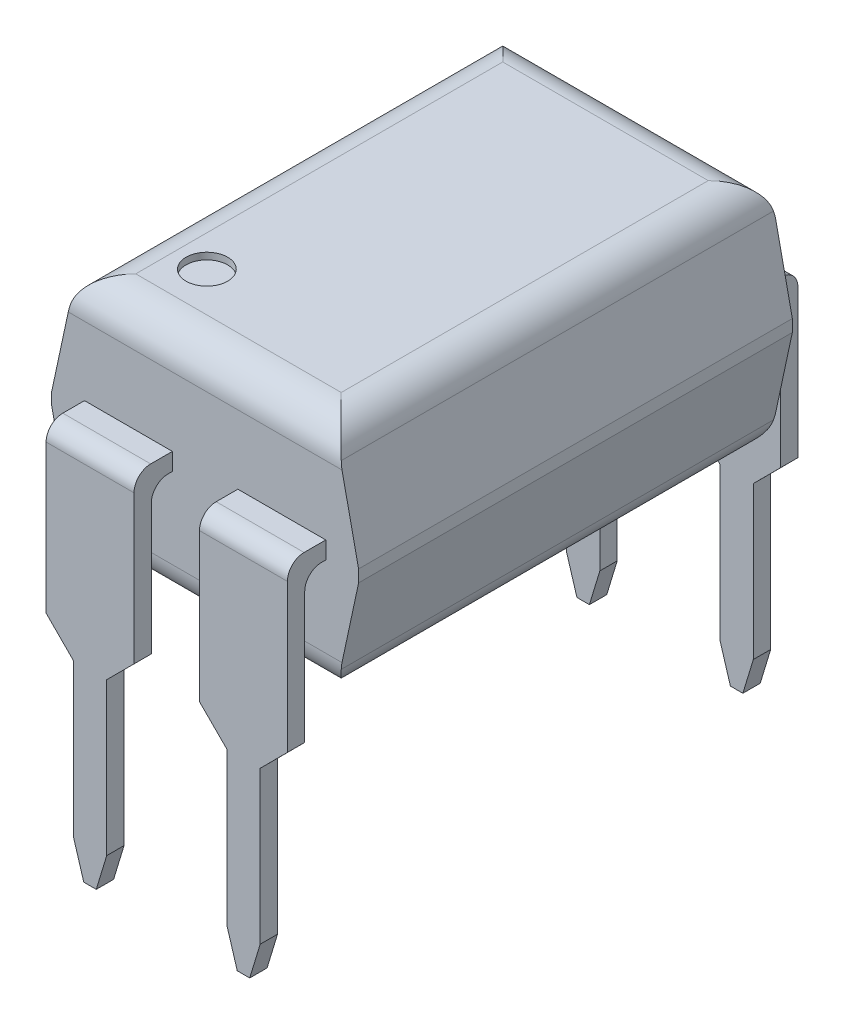
from build123d import *

# Parameters (mm, degrees)
SKETCH1_W               = 4.6
SKETCH1_H               = 6.5
BOSS_EXTRUDE1_DEPTH     = 3.5
SKETCH2_R               = 0.311751624
CUT_EXTRUDE1_DEPTH      = 0.1
SKETCH3_OUTSIDE_W       = 8.34
SKETCH3_OUTSIDE_H       = 7.24
CUT_EXTRUDE3_DEPTH      = 8.732399369
FILLET1_R               = 0.5
BOSS_EXTRUDE2_DEPTH     = 4.6
CUT_EXTRUDE7_DEPTH      = 9.807718938
CUT_EXTRUDE7_DEPTH_BACK = 9.807718938
SKETCH5_OUTSIDE_W       = 8.894
SKETCH5_OUTSIDE_H       = 11.503


with BuildPart() as part:
    # Sketch1 → Boss-Extrude1 (new body)
    with BuildSketch(Plane(origin=(0, 0, 0), x_dir=(1, 0, 0), z_dir=(0, 1, 0))):
        Rectangle(SKETCH1_W, SKETCH1_H)
    extrude(amount=BOSS_EXTRUDE1_DEPTH)

    # Sketch2 → Cut-Extrude1 (cut)
    with BuildSketch(Plane(origin=(0, 3.5, 0), x_dir=(1, 0, 0), z_dir=(0, 1, 0))):
        with Locations(Location((-1.067569718, -2.156407837, 0), (0, 0, 270))):
            Circle(SKETCH2_R)
    extrude(amount=-CUT_EXTRUDE1_DEPTH, mode=Mode.SUBTRACT)

    # Sketch3 outside → Cut-Extrude3 (cut, through all)
    with BuildSketch(Plane.XY.offset(3.25)):
        with Locations((0, 1.75)):
            Rectangle(SKETCH3_OUTSIDE_W, SKETCH3_OUTSIDE_H)
        Polygon((-2.3, 1.84057033), (-1.943948555, 3.5), (1.943948555, 3.5), (2.3, 1.84057033), (2.3, 1.65942967), (1.943948555, 0), (-1.943948555, 0), (-2.3, 1.65942967), align=None, mode=Mode.SUBTRACT)
    extrude(amount=-CUT_EXTRUDE3_DEPTH, mode=Mode.SUBTRACT)

    # Fillet1
    fillet1_edges = [part.edges().sort_by_distance(p)[0] for p in [
        (0, 0, 3.25),
        (0, 0, -3.25),
        (0, 3.5, -3.25),
        (0, 3.5, 3.25),
        (1.943948555, 3.5, 0),
        (-1.943948555, 3.5, 0),
        (1.943948555, 0, 0),
        (-1.943948555, 0, 0),
    ]]
    fillet(fillet1_edges, radius=FILLET1_R)


with BuildPart() as body_2:
    # Sketch4 → Boss-Extrude2 (new, through all)
    with BuildSketch(Plane.ZY.offset(2.3)):
        with BuildLine():
            Line((-3.825115829, -3.70942967), (-3.565115829, -3.70942967))
            Line((-3.565115829, -3.70942967), (-3.565115829, 1.46057033))
            ThreePointArc((-3.565115829, 1.46057033), (-3.491892524, 1.637347026), (-3.315115829, 1.71057033))
            Line((-3.315115829, 1.71057033), (3.315115829, 1.71057033))
            ThreePointArc((3.315115829, 1.71057033), (3.491892524, 1.637347026), (3.565115829, 1.46057033))
            Line((3.565115829, 1.46057033), (3.565115829, -3.70942967))
            Line((3.565115829, -3.70942967), (3.825115829, -3.70942967))
            Line((3.825115829, -3.70942967), (3.825115829, 1.72057033))
            ThreePointArc((3.825115829, 1.72057033), (3.751892524, 1.897347026), (3.575115829, 1.97057033))
            Line((3.575115829, 1.97057033), (-3.575115829, 1.97057033))
            ThreePointArc((-3.575115829, 1.97057033), (-3.751892524, 1.897347026), (-3.825115829, 1.72057033))
            Line((-3.825115829, 1.72057033), (-3.825115829, -3.70942967))
        make_face()
    extrude(amount=-BOSS_EXTRUDE2_DEPTH)

    # Sketch5 outside → Cut-Extrude7 (cut, two sides: drawn at the far end of the back side and taken through both)
    with BuildSketch(Plane(origin=(0, 0, -3.825115829), x_dir=(-1, 0, 0), z_dir=(0, 0, -1)).offset(-CUT_EXTRUDE7_DEPTH_BACK)):
        with Locations((0, -0.1045)):
            Rectangle(SKETCH5_OUTSIDE_W, SKETCH5_OUTSIDE_H)
        Polygon((-0.9, -3.19277423), (-0.9, -0.90942967), (-0.490520763, -0.5), (-0.490520763, 1.72057033), (-0.490520763, 1.973134899), (-1.807848204, 1.973134899), (-1.807848204, 1.72057033), (-1.807848204, -0.5), (-1.4, -0.90942967), (-1.4, -3.19277423), (-1.243452684, -3.70942967), (-1.056547316, -3.70942967), align=None, mode=Mode.SUBTRACT)
        Polygon((1.4, -0.90942967), (1.807848204, -0.5), (1.807848204, 1.72057033), (1.807848204, 1.973134899), (0.490520763, 1.973134899), (0.490520763, 1.72057033), (0.490520763, -0.5), (0.9, -0.90942967), (0.9, -3.19277423), (1.056547316, -3.70942967), (1.243452684, -3.70942967), (1.4, -3.19277423), align=None, mode=Mode.SUBTRACT)
    extrude(amount=CUT_EXTRUDE7_DEPTH + CUT_EXTRUDE7_DEPTH_BACK, mode=Mode.SUBTRACT)


with BuildPart() as cut_extrude7_piece_1:
    # of the separate pieces the step leaves, piece 1, a body of its own (cut_extrude7_pieces)
    add(body_2.part.solids().sort_by_distance((-1.243452684, -3.70942967, -3.565115829))[0])


with BuildPart() as cut_extrude7_piece_2:
    # of the separate pieces the step leaves, piece 2, a body of its own (cut_extrude7_pieces)
    add(body_2.part.solids().sort_by_distance((1.056547316, -3.70942967, -3.565115829))[0])


solid = Compound([part.part, cut_extrude7_piece_1.part, cut_extrude7_piece_2.part])
